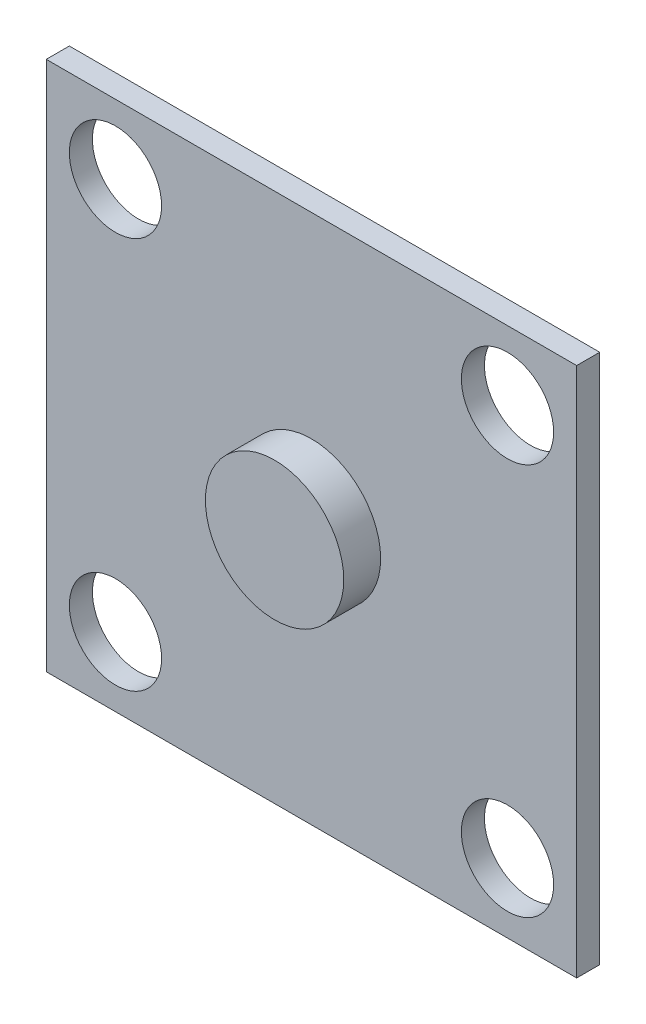
from build123d import *

# Parameters (mm, degrees)
SKETCH_1_W      = 23
SKETCH_1_H      = 23
SKETCH_1_R      = 2
EXTRUDE_1_DEPTH = 1
SKETCH_2_R      = 3
EXTRUDE_2_DEPTH = 1.6


with BuildPart() as part:
    # 草图1 → 凸台-拉伸1 (new body)
    with BuildSketch(Plane.XY):
        with Locations((-3.276041667, 5.622395833)):
            Rectangle(SKETCH_1_W, SKETCH_1_H)
        with Locations((-11.776041667, 14.122395833)):
            Circle(SKETCH_1_R, mode=Mode.SUBTRACT)
        with Locations((-11.776041667, -2.877604167)):
            Circle(SKETCH_1_R, mode=Mode.SUBTRACT)
        with Locations((5.223958333, -2.877604167)):
            Circle(SKETCH_1_R, mode=Mode.SUBTRACT)
        with Locations((5.223958333, 14.122395833)):
            Circle(SKETCH_1_R, mode=Mode.SUBTRACT)
    extrude(amount=EXTRUDE_1_DEPTH)

    # 草图2 → 凸台-拉伸2 (add)
    with BuildSketch(Plane.XY.offset(1)):
        with Locations((-3.276041667, 5.622395833)):
            Circle(SKETCH_2_R)
    extrude(amount=EXTRUDE_2_DEPTH)


solid = part.part
